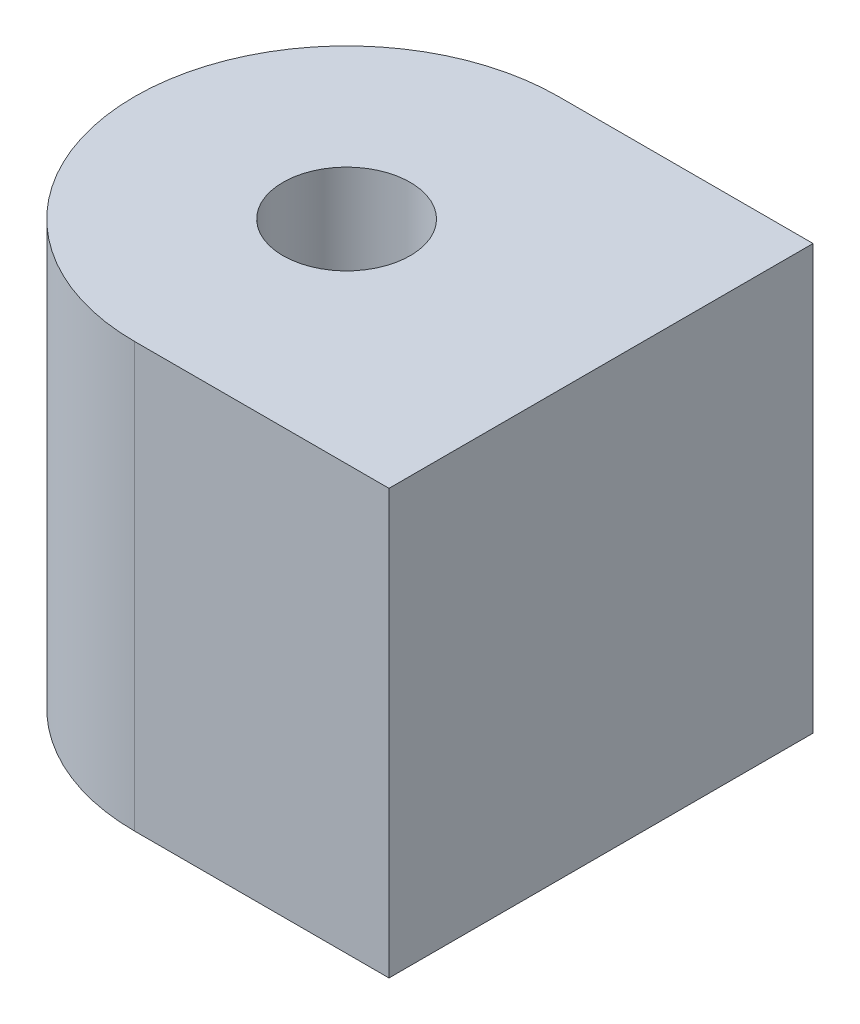
from build123d import *

# Parameters (mm, degrees)
BOSS_EXTRUDE1_DEPTH = 20
SKETCH2_R           = 7.5
BOSS_EXTRUDE2_DEPTH = 30


with BuildPart() as part:
    # Sketch1 → Boss-Extrude1 (new body)
    with BuildSketch(Plane(origin=(0, 0, 0), x_dir=(1, 0, 0), z_dir=(0, 1, 0))):
        with BuildLine():
            Line((0, -25), (30, -25))
            Line((30, -25), (30, 25))
            Line((30, 25), (0, 25))
            ThreePointArc((0, 25), (-25, 0), (0, -25))
        make_face()
        with BuildLine():
            Line((3.75, 6.5), (2.47446787, 15.356382884))
            ThreePointArc((2.47446787, 15.356382884), (0, 17.5), (-2.47446787, 15.356382884))
            Line((-2.47446787, 15.356382884), (-3.75, 6.5))
            Line((-3.75, 6.5), (-3.754165125, 6.497595264))
            Line((-3.754165125, 6.497595264), (-12.061783753, 9.821143478))
            ThreePointArc((-12.061783753, 9.821143478), (-15.155444566, 8.75), (-14.536251623, 5.535239406))
            Line((-14.536251623, 5.535239406), (-7.504165125, 0.002404736))
            Line((-7.504165125, 0.002404736), (-7.504165125, -0.002404736))
            Line((-7.504165125, -0.002404736), (-14.536251623, -5.535239406))
            ThreePointArc((-14.536251623, -5.535239406), (-15.155444566, -8.75), (-12.061783753, -9.821143478))
            Line((-12.061783753, -9.821143478), (-3.754165125, -6.497595264))
            Line((-3.754165125, -6.497595264), (-3.75, -6.5))
            Line((-3.75, -6.5), (-2.47446787, -15.356382884))
            ThreePointArc((-2.47446787, -15.356382884), (0, -17.5), (2.47446787, -15.356382884))
            Line((2.47446787, -15.356382884), (3.75, -6.5))
            Line((3.75, -6.5), (3.754165125, -6.497595264))
            Line((3.754165125, -6.497595264), (12.061783753, -9.821143478))
            ThreePointArc((12.061783753, -9.821143478), (15.155444566, -8.75), (14.536251623, -5.535239406))
            Line((14.536251623, -5.535239406), (7.504165125, -0.002404736))
            Line((7.504165125, -0.002404736), (7.504165125, 0.002404736))
            Line((7.504165125, 0.002404736), (14.536251623, 5.535239406))
            ThreePointArc((14.536251623, 5.535239406), (15.155444566, 8.75), (12.061783753, 9.821143478))
            Line((12.061783753, 9.821143478), (3.754165125, 6.497595264))
            Line((3.754165125, 6.497595264), (3.75, 6.5))
        make_face(mode=Mode.SUBTRACT)
    extrude(amount=BOSS_EXTRUDE1_DEPTH)

    # Sketch2 → Boss-Extrude2 (add)
    with BuildSketch(Plane(origin=(0, 20, 0), x_dir=(1, 0, 0), z_dir=(0, 1, 0))):
        with BuildLine():
            Line((0, 25), (30, 25))
            Line((30, 25), (30, -25))
            Line((30, -25), (0, -25))
            ThreePointArc((0, -25), (-25, 0), (0, 25))
        make_face()
        with Locations(Location((0, 0, 0), (0, 0, 270))):
            Circle(SKETCH2_R, mode=Mode.SUBTRACT)
    extrude(amount=BOSS_EXTRUDE2_DEPTH)


solid = part.part
